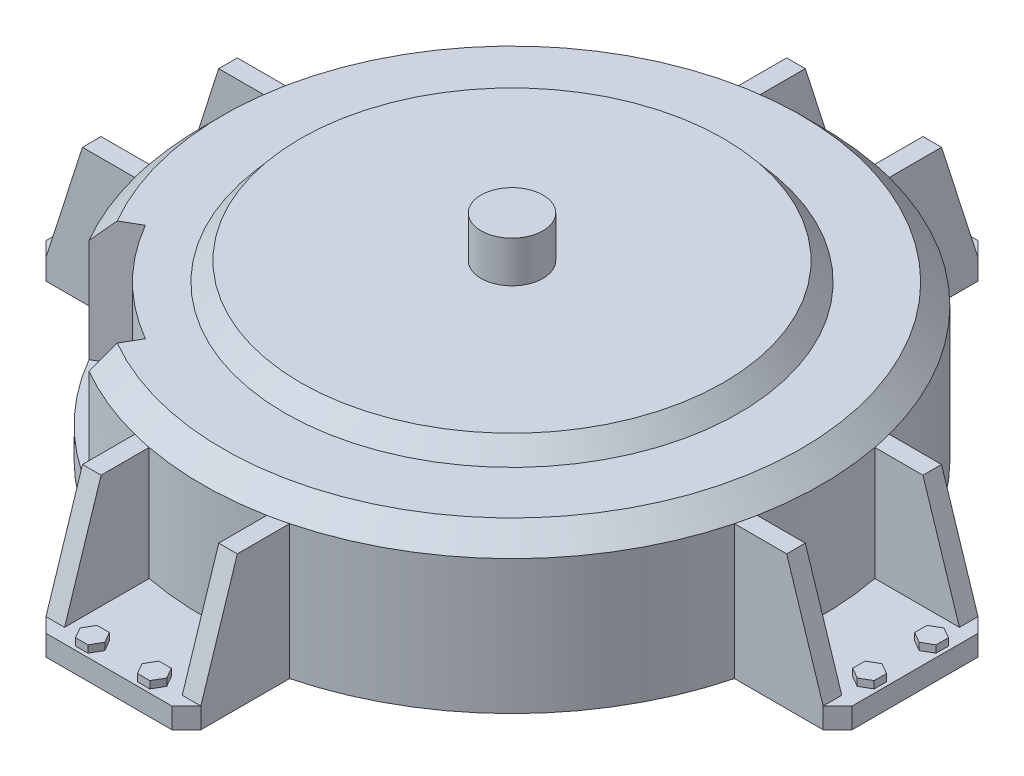
from build123d import *

# Parameters (mm, degrees)
SKETCH1_R                    = 150
BOSS_EXTRUDE1_DEPTH          = 75
CHAMFER1_SIZE                = 10
BOSS_EXTRUDE2_START          = -75
BOSS_EXTRUDE2_DEPTH          = 10
CHAMFER2_SIZE                = 7
BOSS_EXTRUDE3_DEPTH          = 9
BOSS_EXTRUDE4_DEPTH          = 3.5
CIRPATTERN1_COUNT            = 4
CIRPATTERN1_COPY_1_DEPTH     = 9
CIRPATTERN1_COPY_2_DEPTH     = 9
CIRPATTERN1_COPY_3_DEPTH     = 9
CIRPATTERN1_COPY_4_DEPTH     = 3.5
CIRPATTERN1_COPY_5_DEPTH     = 3.5
CIRPATTERN1_COPY_6_DEPTH     = 3.5
CHAMFER2_OF_CIRPATTERN1_SIZE = 7
CUT_EXTRUDE1_START           = -60
CUT_EXTRUDE1_DEPTH           = 60
SKETCH6_R                    = 110
BOSS_EXTRUDE5_DEPTH          = 9
BOSS_EXTRUDE5_TAPER          = 40
SKETCH7_R                    = 15
BOSS_EXTRUDE6_DEPTH          = 20


with BuildPart() as part:
    # Sketch1 → Boss-Extrude1 (new body)
    with BuildSketch(Plane(origin=(0, 0, 0), x_dir=(1, 0, 0), z_dir=(0, 1, 0))):
        with Locations(Location((0, 0, 0), (0, 0, 270))):
            Circle(SKETCH1_R)
    extrude(amount=BOSS_EXTRUDE1_DEPTH)

    # Chamfer1
    chamfer1_edges = [part.edges().sort_by_distance(p)[0] for p in [
        (0, 75, -150),
    ]]
    chamfer(chamfer1_edges, length=CHAMFER1_SIZE)

    # Sketch2 → Boss-Extrude2 (add)
    with BuildSketch(Plane(origin=(0, 75, 0), x_dir=(1, 0, 0), z_dir=(0, 1, 0)).offset(BOSS_EXTRUDE2_START)):
        with BuildLine():
            Line((-145.236875483, 37.5), (-195.236875483, 37.5))
            Line((-195.236875483, 37.5), (-195.236875483, -37.5))
            Line((-195.236875483, -37.5), (-145.236875483, -37.5))
            ThreePointArc((-145.236875483, -37.5), (-150, 0), (-145.236875483, 37.5))
        make_face()
    boss_extrude2 = extrude(amount=BOSS_EXTRUDE2_DEPTH)

    # Chamfer2
    chamfer2_edges = [part.edges().sort_by_distance(p)[0] for p in [
        (-195.236875483, 5, -37.5),
        (-195.236875483, 5, 37.5),
    ]]
    chamfer(chamfer2_edges, length=CHAMFER2_SIZE)

    # Sketch3 → Boss-Extrude3 (add)
    with BuildSketch(Plane.XY.offset(37.5)):
        Polygon((-145.236875483, 10), (-145.236875483, 65), (-170.556875483, 65), (-188.236875483, 10), align=None)
    boss_extrude3 = extrude(amount=-BOSS_EXTRUDE3_DEPTH)

    # Sketch4 → Boss-Extrude4 (add)
    with BuildSketch(Plane(origin=(0, 10, 0), x_dir=(1, 0, 0), z_dir=(0, 1, 0))):
        Polygon((-188.236875483, -21), (-183.04072306, -18), (-183.04072306, -12), (-188.236875483, -9), (-193.433027905, -12), (-193.433027905, -18), align=None)
    boss_extrude4 = extrude(amount=BOSS_EXTRUDE4_DEPTH)

    # Mirror1: Boss-Extrude3, Boss-Extrude4 across plane
    add(boss_extrude3.mirror(Plane.XY))
    add(boss_extrude4.mirror(Plane.XY))

    # CirPattern1: Boss-Extrude2, Boss-Extrude3, Boss-Extrude4 ×4 about axis
    cirpattern1_axis = Axis((0, 0, 0), (0, 1, 0))
    add([boss_extrude2.rotate(cirpattern1_axis, i * 360 / CIRPATTERN1_COUNT) for i in range(1, CIRPATTERN1_COUNT)])
    add([boss_extrude3.rotate(cirpattern1_axis, i * 360 / CIRPATTERN1_COUNT) for i in range(1, CIRPATTERN1_COUNT)])
    add([boss_extrude4.rotate(cirpattern1_axis, i * 360 / CIRPATTERN1_COUNT) for i in range(1, CIRPATTERN1_COUNT)])

    # CirPattern1 copy 1 sketch → CirPattern1 copy 1 (add)
    with BuildSketch(Plane(origin=(-37.5, 0, 0), x_dir=(0, 0, -1), z_dir=(-1, 0, 0))):
        Polygon((-145.236875483, -10), (-145.236875483, -65), (-170.556875483, -65), (-188.236875483, -10), align=None)
    extrude(amount=-CIRPATTERN1_COPY_1_DEPTH)

    # CirPattern1 copy 2 sketch → CirPattern1 copy 2 (add)
    with BuildSketch(Plane(origin=(0, 0, 37.5), x_dir=(-1, 0, 0), z_dir=(0, 0, 1))):
        Polygon((-145.236875483, -10), (-145.236875483, -65), (-170.556875483, -65), (-188.236875483, -10), align=None)
    extrude(amount=-CIRPATTERN1_COPY_2_DEPTH)

    # CirPattern1 copy 3 sketch → CirPattern1 copy 3 (add)
    with BuildSketch(Plane(origin=(37.5, 0, 0), x_dir=(0, 0, 1), z_dir=(1, 0, 0))):
        Polygon((-145.236875483, -10), (-145.236875483, -65), (-170.556875483, -65), (-188.236875483, -10), align=None)
    extrude(amount=-CIRPATTERN1_COPY_3_DEPTH)

    # CirPattern1 copy 4 sketch → CirPattern1 copy 4 (add)
    with BuildSketch(Plane(origin=(0, 10, 0), x_dir=(0, 0, -1), z_dir=(0, 1, 0))):
        Polygon((-188.236875483, 21), (-183.04072306, 18), (-183.04072306, 12), (-188.236875483, 9), (-193.433027905, 12), (-193.433027905, 18), align=None)
    extrude(amount=CIRPATTERN1_COPY_4_DEPTH)

    # CirPattern1 copy 5 sketch → CirPattern1 copy 5 (add)
    with BuildSketch(Plane(origin=(0, 10, 0), x_dir=(-1, 0, 0), z_dir=(0, 1, 0))):
        Polygon((-188.236875483, 21), (-183.04072306, 18), (-183.04072306, 12), (-188.236875483, 9), (-193.433027905, 12), (-193.433027905, 18), align=None)
    extrude(amount=CIRPATTERN1_COPY_5_DEPTH)

    # CirPattern1 copy 6 sketch → CirPattern1 copy 6 (add)
    with BuildSketch(Plane.ZX.offset(10)):
        Polygon((-188.236875483, 21), (-183.04072306, 18), (-183.04072306, 12), (-188.236875483, 9), (-193.433027905, 12), (-193.433027905, 18), align=None)
    extrude(amount=CIRPATTERN1_COPY_6_DEPTH)

    # Chamfer2 of CirPattern1
    chamfer2_of_cirpattern1_edges = [part.edges().sort_by_distance(p)[0] for p in [
        (-37.5, 5, 195.236875483),
        (37.5, 5, 195.236875483),
        (195.236875483, 5, 37.5),
        (195.236875483, 5, -37.5),
        (37.5, 5, -195.236875483),
        (-37.5, 5, -195.236875483),
    ]]
    chamfer(chamfer2_of_cirpattern1_edges, length=CHAMFER2_OF_CIRPATTERN1_SIZE)

    # Sketch5 → Cut-Extrude1 (cut)
    with BuildSketch(Plane(origin=(0, 75, 0), x_dir=(1, 0, 0), z_dir=(0, 1, 0)).offset(CUT_EXTRUDE1_START)):
        with BuildLine():
            ThreePointArc((-70, -121.24355653), (-98.994949366, -98.994949366), (-121.24355653, -70))
            Line((-121.24355653, -70), (-129.903810568, -75))
            ThreePointArc((-129.903810568, -75), (-106.066017178, -106.066017178), (-75, -129.903810568))
            Line((-75, -129.903810568), (-70, -121.24355653))
        make_face()
        with BuildLine():
            ThreePointArc((-65, -112.583302492), (-91.923881554, -91.923881554), (-112.583302492, -65))
            Line((-112.583302492, -65), (-121.24355653, -70))
            ThreePointArc((-121.24355653, -70), (-98.994949366, -98.994949366), (-70, -121.24355653))
            Line((-70, -121.24355653), (-65, -112.583302492))
        make_face()
    extrude(amount=CUT_EXTRUDE1_DEPTH, mode=Mode.SUBTRACT)

    # Sketch6 → Boss-Extrude5 (add)
    with BuildSketch(Plane(origin=(0, 75, 0), x_dir=(1, 0, 0), z_dir=(0, 1, 0))):
        Circle(SKETCH6_R)
    extrude(amount=BOSS_EXTRUDE5_DEPTH, taper=BOSS_EXTRUDE5_TAPER)

    # Sketch7 → Boss-Extrude6 (add)
    with BuildSketch(Plane(origin=(0, 84, 0), x_dir=(1, 0, 0), z_dir=(0, 1, 0))):
        with Locations(Location((0, 0, 0), (0, 0, 270))):
            Circle(SKETCH7_R)
    extrude(amount=BOSS_EXTRUDE6_DEPTH)


solid = part.part
